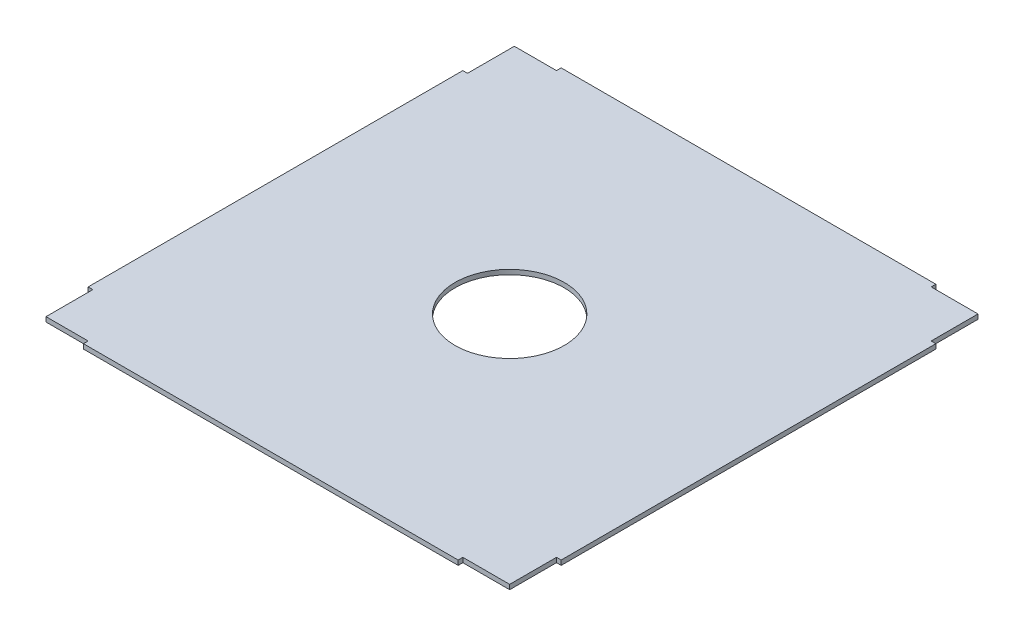
from build123d import *

# Parameters (mm, degrees)
BOSS_EXTRUDE1_DEPTH = 3
SKETCH2_R           = 35
CUT_EXTRUDE1_DEPTH  = 3


with BuildPart() as part:
    # Sketch1 → Boss-Extrude1 (new body)
    with BuildSketch(Plane(origin=(0, 0, 0), x_dir=(1, 0, 0), z_dir=(0, 1, 0))):
        Polygon((-267, 136.567741935), (-240, 136.567741935), (-240, 139.567741935), (0, 139.567741935), (0, 136.567741935), (30, 136.567741935), (30, 106.567741935), (33, 106.567741935), (33, -133.432258065), (30, -133.432258065), (30, -163.432258065), (0, -163.432258065), (0, -166.432258065), (-240, -166.432258065), (-240, -163.432258065), (-267, -163.432258065), (-267, -133.432258065), (-270, -133.432258065), (-270, 106.567741935), (-267, 106.567741935), align=None)
    extrude(amount=BOSS_EXTRUDE1_DEPTH)

    # Sketch2 → Cut-Extrude1 (cut)
    with BuildSketch(Plane(origin=(0, 3, 0), x_dir=(1, 0, 0), z_dir=(0, 1, 0))):
        with Locations(Location((-120, -13.432258065, 0), (0, 0, 270))):
            Circle(SKETCH2_R)
    extrude(amount=-CUT_EXTRUDE1_DEPTH, mode=Mode.SUBTRACT)


solid = part.part
